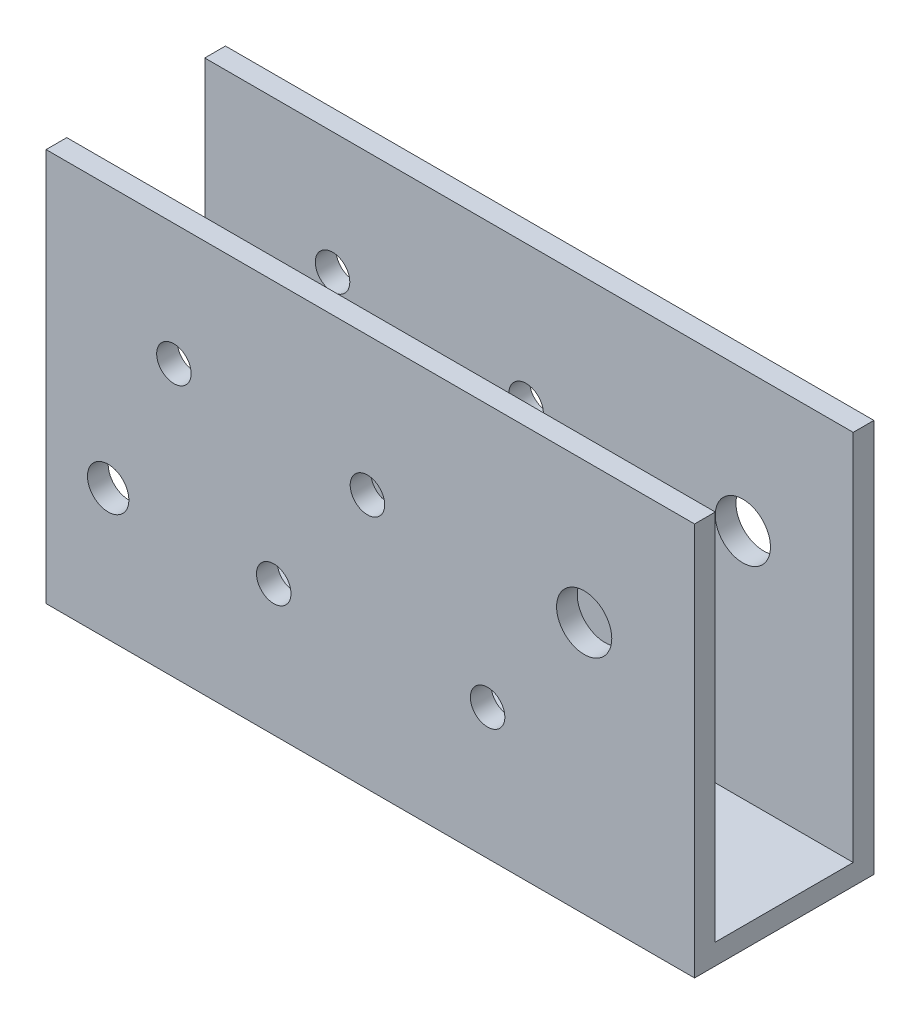
from build123d import *

# Parameters (mm, degrees)
SKETCH_1_W          = 94
SKETCH_1_H          = 26
EXTRUDE_1_DEPTH     = 3
SKETCH_2_W          = 94
SKETCH_2_H          = 3
EXTRUDE_2_DEPTH     = 54
SKETCH_3_R          = 3
SKETCH_3_R_2        = 2.5
SKETCH_3_R_3        = 4
CUT_EXTRUDE_1_DEPTH = 79.319856997


with BuildPart() as part:
    # 스케치1 → 보스-돌출1 (new body)
    with BuildSketch(Plane(origin=(0, 0, 0), x_dir=(1, 0, 0), z_dir=(0, 1, 0))):
        Rectangle(SKETCH_1_W, SKETCH_1_H)
    extrude(amount=EXTRUDE_1_DEPTH)

    # 스케치2 → 보스-돌출2 (add)
    with BuildSketch(Plane(origin=(0, 3, 0), x_dir=(1, 0, 0), z_dir=(0, 1, 0))):
        with Locations((0, 11.5)):
            Rectangle(SKETCH_2_W, SKETCH_2_H)
        with Locations((0, -11.5)):
            Rectangle(SKETCH_2_W, SKETCH_2_H)
    extrude(amount=EXTRUDE_2_DEPTH)

    # 스케치3 → 컷-돌출1 (cut, through all)
    with BuildSketch(Plane.XY.offset(13)):
        with Locations((-38, 19)):
            Circle(SKETCH_3_R)
        with Locations((17, 19)):
            Circle(SKETCH_3_R_2)
        with Locations((-14, 19)):
            Circle(SKETCH_3_R_2)
        with Locations((-28.473958333, 39.383928232)):
            Circle(SKETCH_3_R_2)
        with Locations((-0.415322581, 36.936179621)):
            Circle(SKETCH_3_R_2)
        with Locations((31, 36.613914954)):
            Circle(SKETCH_3_R_3)
    extrude(amount=-CUT_EXTRUDE_1_DEPTH, mode=Mode.SUBTRACT)


solid = part.part
